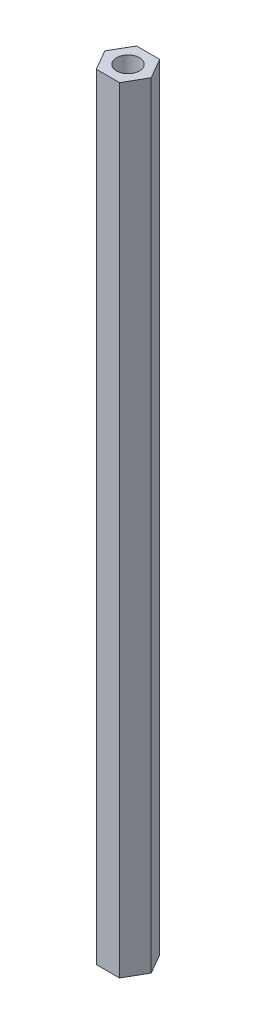
from build123d import *

# Parameters (mm, degrees)
SKETCH1_R           = 2
BOSS_EXTRUDE1_DEPTH = 135


with BuildPart() as part:
    # Sketch1 → Boss-Extrude1 (new body)
    with BuildSketch(Plane(origin=(0, 0, 0), x_dir=(1, 0, 0), z_dir=(0, 1, 0))):
        Polygon((2.020725942, 3.5), (-2.020725942, 3.5), (-4.041451884, 0), (-2.020725942, -3.5), (2.020725942, -3.5), (4.041451884, 0), align=None)
        with Locations(Location((0, 0, 0), (0, 0, 270))):
            Circle(SKETCH1_R, mode=Mode.SUBTRACT)
    extrude(amount=BOSS_EXTRUDE1_DEPTH)


solid = part.part
